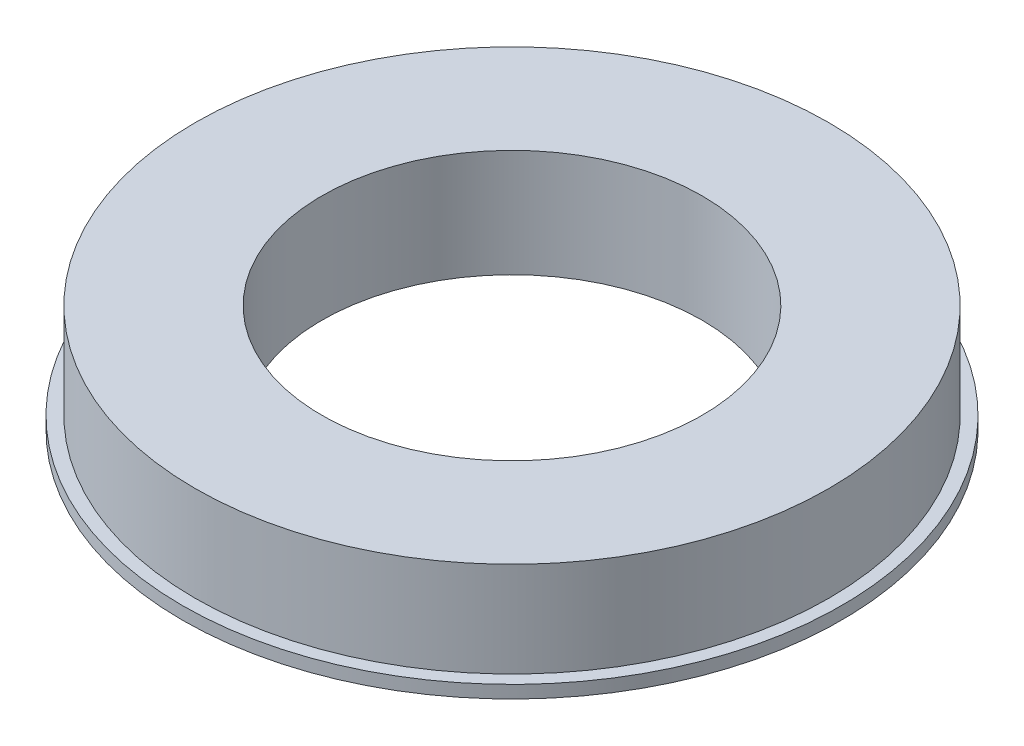
from build123d import *

# Parameters (mm, degrees)
SKETCH1_R           = 66.04
BOSS_EXTRUDE1_DEPTH = 2.54
SKETCH2_R           = 63.5
SKETCH2_R_2         = 38.1
BOSS_EXTRUDE2_DEPTH = 19.05
CUT_EXTRUDE1_START  = -10
SKETCH3_R           = 38.1
CUT_EXTRUDE1_DEPTH  = 10


with BuildPart() as part:
    # Sketch1 → Boss-Extrude1 (new body)
    with BuildSketch(Plane(origin=(0, 0, 0), x_dir=(1, 0, 0), z_dir=(0, 1, 0))):
        with Locations(Location((0, 0, 0), (0, 0, 270))):
            Circle(SKETCH1_R)
    extrude(amount=BOSS_EXTRUDE1_DEPTH)

    # Sketch2 → Boss-Extrude2 (add)
    with BuildSketch(Plane(origin=(0, 2.54, 0), x_dir=(1, 0, 0), z_dir=(0, 1, 0))):
        with Locations(Location((0, 0, 0), (0, 0, 90))):
            Circle(SKETCH2_R)
        with Locations(Location((0, 0, 0), (0, 0, 90))):
            Circle(SKETCH2_R_2, mode=Mode.SUBTRACT)
    extrude(amount=BOSS_EXTRUDE2_DEPTH)

    # Sketch3 → Cut-Extrude1 (cut)
    with BuildSketch(Plane(origin=(0, 2.54, 0), x_dir=(1, 0, 0), z_dir=(0, 1, 0)).offset(CUT_EXTRUDE1_START)):
        with Locations(Location((0, 0, 0), (0, 0, 90))):
            Circle(SKETCH3_R)
    extrude(amount=CUT_EXTRUDE1_DEPTH, mode=Mode.SUBTRACT)


solid = part.part
